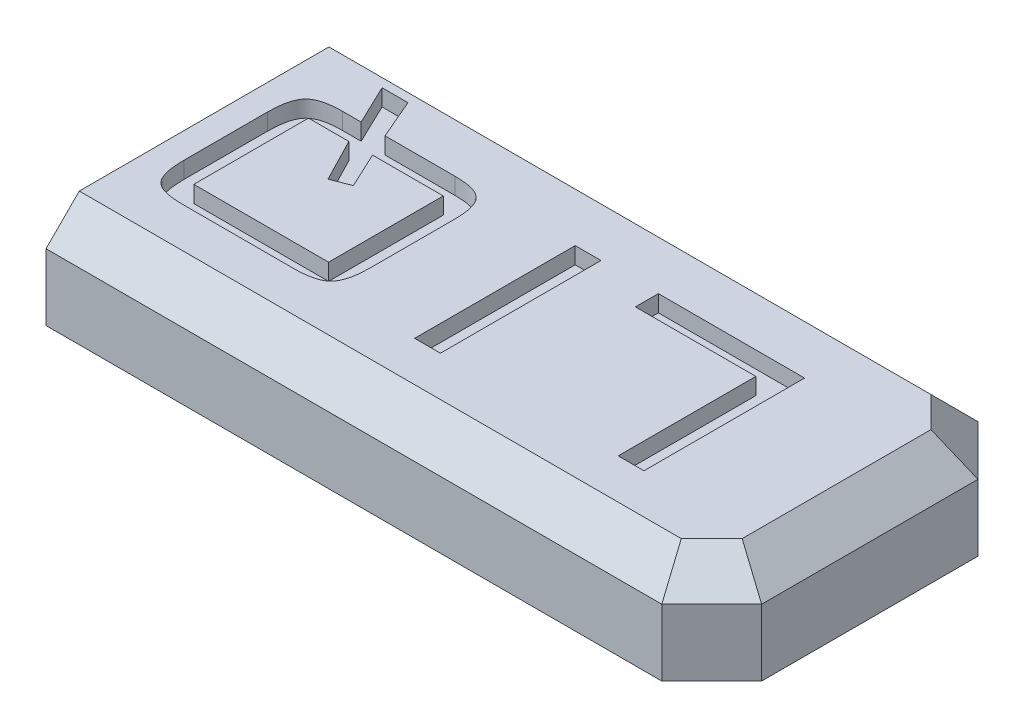
from build123d import *

# Parameters (mm, degrees)
BOSS_EXTRUDE1_DEPTH = 6
SKETCH2_W           = 1.55073591
SKETCH2_H           = 9.649023438
SKETCH2_W_2         = 1.550735909
CUT_EXTRUDE1_DEPTH  = 1
SKETCH4_W           = 43.347942051
SKETCH4_H           = 26.329646459
CUT_EXTRUDE2_DEPTH  = 10
CHAMFER1_SIZE       = 3
CHAMFER2_SIZE       = 2
SKETCH5_W           = 34.860169367
SKETCH5_H           = 17.866082473
CUT_EXTRUDE3_DEPTH  = 0.5
SKETCH6_R           = 4.1
CUT_EXTRUDE4_DEPTH  = 3.4


with BuildPart() as part:
    # Sketch1 → Boss-Extrude1 (new body)
    with BuildSketch(Plane(origin=(0, -196.798939869, 0), x_dir=(1, 0, 0), z_dir=(0, 1, 0))):
        Polygon((-110.695481055, -390.620141885), (-70.695481055, -390.620141885), (-70.695481055, -409.620141885), (-110.695481055, -409.620141885), (-151.695481055, -409.620141885), (-151.695481055, -390.620141885), align=None)
    extrude(amount=BOSS_EXTRUDE1_DEPTH)

    # Sketch2 → Cut-Extrude1 (cut)
    # profile 1 of 6: a face of its own
    with BuildSketch(Plane(origin=(0, -190.798939869, 0), x_dir=(1, 0, 0), z_dir=(0, 1, 0))):
        with BuildLine():
            add(Edge.make_bspline(
                [(-140.767176982, -405.209924667), (-140.982622928, -405.208412821), (-141.394982016, -405.205519181), (-141.98403336, -405.168701103), (-142.517358029, -405.117955452), (-142.996891336, -405.040429638), (-143.431861328, -404.937751856), (-143.828275274, -404.808826708), (-144.192604534, -404.655107583), (-144.412843494, -404.524922655), (-144.520173264, -404.46147921)],
                knots=[0, 0, 0, 0, 1.333778163, 2.552823848, 3.653108193, 4.649746513, 5.558133507, 6.417402386, 7.228747549, 8, 8, 8, 8], degree=3))
            add(Edge.make_bspline(
                [(-144.520173264, -404.46147921), (-144.672688651, -404.354540566), (-144.977706991, -404.140671998), (-145.372980808, -403.740179693), (-145.72204175, -403.288685781), (-146.015251375, -402.783895607), (-146.252341242, -402.23844628), (-146.422101614, -401.66260039), (-146.524137936, -401.061196848), (-146.537803169, -400.652341907), (-146.544745145, -400.444642444)],
                knots=[0, 0, 0, 0, 0.952297785, 1.904517931, 2.867930349, 3.869019748, 4.885904814, 5.906780791, 6.936638737, 8, 8, 8, 8], degree=3))
            add(Edge.make_bspline(
                [(-146.544745145, -400.444642444), (-146.539017026, -400.224388593), (-146.527802756, -399.793184944), (-146.425839385, -399.164163809), (-146.258098069, -398.569953885), (-146.027848138, -398.012133469), (-145.734933397, -397.499500284), (-145.384408604, -397.041985203), (-144.985328734, -396.634035669), (-144.675593052, -396.417833194), (-144.520173264, -396.309346685)],
                knots=[0, 0, 0, 0, 1.100129358, 2.153786604, 3.174592563, 4.179911314, 5.162319574, 6.115853573, 7.05456925, 8, 8, 8, 8], degree=3))
            add(Edge.make_bspline(
                [(-144.520173264, -396.309346685), (-144.415407214, -396.247970567), (-144.198209286, -396.120727383), (-143.840423238, -395.967019912), (-143.444768852, -395.841274433), (-143.011380567, -395.735735637), (-142.529145335, -395.655193263), (-141.993148894, -395.601522013), (-141.399450617, -395.565451573), (-140.984411915, -395.562464625), (-140.767176982, -395.560901229)],
                knots=[0, 0, 0, 0, 0.751413761, 1.557809164, 2.404944974, 3.320203742, 4.317937033, 5.430050062, 6.654865437, 8, 8, 8, 8], degree=3))
            Line((-140.767176982, -395.560901229), (-135.517289788, -395.560901229))
            Line((-135.517289788, -395.560901229), (-135.517289788, -405.209924667))
            Line((-135.517289788, -405.209924667), (-140.767176982, -405.209924667))
        make_face()
        with BuildLine():
            Line((-140.538335746, -403.831492747), (-137.068025698, -403.831492747))
            Line((-137.068025698, -403.831492747), (-137.068025698, -396.939333149))
            Line((-137.068025698, -396.939333149), (-140.538335746, -396.939333149))
            add(Edge.make_bspline(
                [(-140.538335746, -396.939333149), (-140.726862755, -396.941898287), (-141.089956251, -396.946838613), (-141.61301485, -396.984845883), (-142.093527417, -397.044798091), (-142.531495923, -397.132160177), (-142.925368528, -397.248552244), (-143.278930228, -397.383732816), (-143.589154837, -397.547989389), (-143.856977936, -397.741453756), (-144.088661152, -397.964049484), (-144.285418794, -398.219866085), (-144.453911174, -398.507093156), (-144.587443165, -398.829479607), (-144.695661065, -399.182540893), (-144.769772109, -399.569730192), (-144.811875271, -399.989610443), (-144.818346787, -400.28031641), (-144.821705246, -400.431181195)],
                knots=[0, 0, 0, 0, 1.40931624, 2.714271877, 3.918424909, 5.027624621, 6.048757475, 6.985660279, 7.853111911, 8.665027323, 9.447928266, 10.246427284, 11.070312611, 11.930128696, 12.849083366, 13.826707191, 14.872147839, 16, 16, 16, 16], degree=3))
            add(Edge.make_bspline(
                [(-144.821705246, -400.431181195), (-144.818709771, -400.576712398), (-144.812924864, -400.857764438), (-144.765683368, -401.263673078), (-144.694488189, -401.639383199), (-144.580929863, -401.980833169), (-144.445105089, -402.294186016), (-144.27545686, -402.57538752), (-144.073112413, -402.824282209), (-143.83895635, -403.042456395), (-143.566561363, -403.230826533), (-143.2546296, -403.391353977), (-142.901690894, -403.528470783), (-142.507862117, -403.640795062), (-142.072601063, -403.725173206), (-141.597799376, -403.786080538), (-141.081882008, -403.823960231), (-140.724169188, -403.828917449), (-140.538335746, -403.831492747)],
                knots=[0, 0, 0, 0, 1.1029475, 2.130028734, 3.094733, 3.996236287, 4.852145578, 5.679426148, 6.477428238, 7.276560664, 8.097578654, 8.980088779, 9.930191586, 10.963809582, 12.080624623, 13.288249086, 14.591233026, 16, 16, 16, 16], degree=3))
        make_face(mode=Mode.SUBTRACT)
    # profile 2 of 6: a face of its own
    with BuildSketch(Plane(origin=(0, -190.798939869, 0), x_dir=(1, 0, 0), z_dir=(0, 1, 0))):
        with Locations((-129.745106125, -400.385412948)):
            Rectangle(SKETCH2_W, SKETCH2_H)
    # profile 3 of 6: a face of its own
    with BuildSketch(Plane(origin=(0, -190.798939869, 0), x_dir=(1, 0, 0), z_dir=(0, 1, 0))):
        with BuildLine():
            Line((-115.357722964, -405.209924667), (-115.357722964, -396.939333149))
            Line((-115.357722964, -396.939333149), (-122.422186552, -396.939333149))
            Line((-122.422186552, -396.939333149), (-122.422186552, -405.209924667))
            Line((-122.422186552, -405.209924667), (-123.972922461, -405.209924667))
            Line((-123.972922461, -405.209924667), (-123.972922461, -397.876236094))
            add(Edge.make_bspline(
                [(-123.972922461, -397.876236094), (-123.97130062, -397.768503726), (-123.968175155, -397.560891645), (-123.946562754, -397.263453332), (-123.913361153, -396.992319774), (-123.861781613, -396.749497692), (-123.798905063, -396.532206755), (-123.717930323, -396.342601202), (-123.623893906, -396.179127334), (-123.51405496, -396.039134081), (-123.380645379, -395.924069451), (-123.223997755, -395.826555258), (-123.043098505, -395.743432714), (-122.835801675, -395.677092248), (-122.603622791, -395.623157153), (-122.345091238, -395.586720416), (-122.061773796, -395.565800066), (-121.864927889, -395.56257696), (-121.76258534, -395.560901229)],
                knots=[0, 0, 0, 0, 1.365025829, 2.630554399, 3.777289411, 4.823296905, 5.773086012, 6.639126, 7.429026898, 8.157168554, 8.882463115, 9.649102086, 10.488604984, 11.398409027, 12.402469484, 13.50569655, 14.703181711, 16, 16, 16, 16], degree=3))
            Line((-121.76258534, -395.560901229), (-116.009247426, -395.560901229))
            add(Edge.make_bspline(
                [(-116.009247426, -395.560901229), (-115.906920359, -395.562687865), (-115.710104231, -395.566124284), (-115.427333413, -395.58552546), (-115.171085642, -395.626525893), (-114.940696482, -395.680226348), (-114.733396449, -395.745508539), (-114.553275043, -395.832261863), (-114.396325587, -395.931154528), (-114.266726678, -396.050908492), (-114.154943277, -396.190042043), (-114.062808079, -396.355700348), (-113.981390872, -396.544829811), (-113.917656822, -396.761041229), (-113.866888225, -397.002247145), (-113.833414163, -397.270620412), (-113.811650677, -397.564474201), (-113.808585204, -397.769400211), (-113.806987054, -397.876236094)],
                knots=[0, 0, 0, 0, 1.301446602, 2.503205558, 3.60080036, 4.597332017, 5.510383128, 6.357737689, 7.133266863, 7.860254787, 8.590995162, 9.393593455, 10.262724318, 11.204977956, 12.254718625, 13.394230236, 14.64151108, 16, 16, 16, 16], degree=3))
            Line((-113.806987054, -397.876236094), (-113.806987054, -405.209924667))
            Line((-113.806987054, -405.209924667), (-115.357722964, -405.209924667))
        make_face()
    # profile 4 of 6: a face of its own
    with BuildSketch(Plane(origin=(0, -190.798939869, 0), x_dir=(1, 0, 0), z_dir=(0, 1, 0))):
        with BuildLine():
            add(Edge.make_bspline(
                [(-97.955019978, -402.870359553), (-97.956652565, -402.978088999), (-97.959798739, -403.185695451), (-97.981268964, -403.483172415), (-98.015048775, -403.755050365), (-98.065378023, -403.999133459), (-98.1304323, -404.217037438), (-98.206687836, -404.40992551), (-98.301548404, -404.575336569), (-98.411034046, -404.718120224), (-98.544442988, -404.835934988), (-98.701069946, -404.936199437), (-98.882708774, -405.022503111), (-99.090920415, -405.091152386), (-99.324340246, -405.145039922), (-99.583864206, -405.180769412), (-99.869613361, -405.206059906), (-100.069270672, -405.208599655), (-100.173433849, -405.209924667)],
                knots=[0, 0, 0, 0, 1.356221993, 2.613588442, 3.7529275, 4.803245948, 5.746909319, 6.613424892, 7.408010909, 8.14031288, 8.868419245, 9.636206373, 10.47510186, 11.393329314, 12.390914008, 13.487025728, 14.688956683, 16, 16, 16, 16], degree=3))
            Line((-100.173433849, -405.209924667), (-106.936365454, -405.209924667))
            add(Edge.make_bspline(
                [(-106.936365454, -405.209924667), (-107.03959143, -405.208168009), (-107.237308227, -405.204803345), (-107.521846366, -405.185117085), (-107.779867844, -405.144247356), (-108.01302586, -405.090709797), (-108.221545349, -405.025218465), (-108.404305019, -404.941105061), (-108.562292124, -404.842079279), (-108.695959314, -404.723411798), (-108.805834581, -404.580848257), (-108.899064948, -404.415265905), (-108.981397593, -404.224482592), (-109.043478168, -404.005085856), (-109.09525377, -403.759657576), (-109.128239011, -403.486707323), (-109.150133277, -403.187505345), (-109.153187914, -402.978991502), (-109.154779325, -402.870359553)],
                knots=[0, 0, 0, 0, 1.299210286, 2.488479226, 3.585823455, 4.582994824, 5.497291421, 6.331034297, 7.108000517, 7.835805208, 8.567803767, 9.362060566, 10.222158455, 11.176253704, 12.226136976, 13.376204297, 14.633049786, 16, 16, 16, 16], degree=3))
            Line((-109.154779325, -402.870359553), (-109.154779325, -397.854698095))
            add(Edge.make_bspline(
                [(-109.154779325, -397.854698095), (-109.153151378, -397.747864039), (-109.150015111, -397.542046438), (-109.128503265, -397.247278496), (-109.094894709, -396.978008156), (-109.044020497, -396.736842057), (-108.980901322, -396.521291491), (-108.899001076, -396.334013033), (-108.80658263, -396.171325929), (-108.69573208, -396.033634198), (-108.561285836, -395.920666277), (-108.403637682, -395.824563938), (-108.221581059, -395.740232658), (-108.01335545, -395.674186162), (-107.77970286, -395.624053469), (-107.52162289, -395.586441232), (-107.237333904, -395.5658101), (-107.039600238, -395.562585014), (-106.936365454, -395.560901229)],
                knots=[0, 0, 0, 0, 1.357245466, 2.61475614, 3.753224731, 4.80200455, 5.743395722, 6.6012629, 7.393257341, 8.114460715, 8.834220599, 9.61255537, 10.454283276, 11.377336392, 12.381536746, 13.487687791, 14.68834675, 16, 16, 16, 16], degree=3))
            Line((-106.936365454, -395.560901229), (-105.81908177, -395.560901229))
            Line((-105.81908177, -395.560901229), (-106.974056952, -393.14864537))
            Line((-106.974056952, -393.14864537), (-105.420628793, -393.14864537))
            Line((-105.420628793, -393.14864537), (-104.384112603, -395.560901229))
            Line((-104.384112603, -395.560901229), (-100.173433849, -395.560901229))
            add(Edge.make_bspline(
                [(-100.173433849, -395.560901229), (-100.069299861, -395.562576695), (-99.869770228, -395.565787032), (-99.583710784, -395.586483719), (-99.324398952, -395.623381546), (-99.090777766, -395.67665049), (-98.883528866, -395.746452514), (-98.700271675, -395.828557698), (-98.545451596, -395.929855275), (-98.410938513, -396.044261005), (-98.302420462, -396.184244467), (-98.205884472, -396.345061043), (-98.130494516, -396.534972277), (-98.066128283, -396.748472614), (-98.014313393, -396.98778752), (-97.981722229, -397.253596433), (-97.959616393, -397.545617805), (-97.95659546, -397.74875672), (-97.955019978, -397.854698095)],
                knots=[0, 0, 0, 0, 1.324586597, 2.538021266, 3.64545599, 4.653345889, 5.581058773, 6.423763498, 7.199481985, 7.927542786, 8.658461541, 9.441536144, 10.306446208, 11.248929857, 12.276599877, 13.416389652, 14.652590838, 16, 16, 16, 16], degree=3))
            Line((-97.955019978, -397.854698095), (-97.955019978, -402.870359553))
        make_face()
        Polygon((-105.178326307, -396.939333149), (-107.604043416, -396.939333149), (-107.604043416, -403.831492747), (-99.505755888, -403.831492747), (-99.505755888, -396.939333149), (-103.75412614, -396.939333149), (-102.744532449, -399.106594272), (-103.845662635, -399.523892998), align=None, mode=Mode.SUBTRACT)
    # profile 5 of 6: a face of its own
    with BuildSketch(Plane(origin=(0, -190.798939869, 0), x_dir=(1, 0, 0), z_dir=(0, 1, 0))):
        with Locations((-92.182836315, -400.385412948)):
            Rectangle(SKETCH2_W_2, SKETCH2_H)
    # profile 6 of 6: a face of its own
    with BuildSketch(Plane(origin=(0, -190.798939869, 0), x_dir=(1, 0, 0), z_dir=(0, 1, 0))):
        Polygon((-79.173885073, -395.560901229), (-79.173885073, -405.209924667), (-80.724620983, -405.209924667), (-80.724620983, -396.939333149), (-87.961388561, -396.939333149), (-87.961388561, -395.560901229), align=None)
    extrude(amount=-CUT_EXTRUDE1_DEPTH, mode=Mode.SUBTRACT)

    # Sketch4 → Cut-Extrude2 (cut)
    with BuildSketch(Plane(origin=(0, -190.798939869, 0), x_dir=(1, 0, 0), z_dir=(0, 1, 0))):
        with Locations((-132.86945208, -396.455318656)):
            Rectangle(SKETCH4_W, SKETCH4_H)
    extrude(amount=-CUT_EXTRUDE2_DEPTH, mode=Mode.SUBTRACT)

    # Chamfer1
    chamfer1_edges = [part.edges().sort_by_distance(p)[0] for p in [
        (-70.695481055, -193.798939869, 390.620141885),
        (-70.695481055, -193.798939869, 409.620141885),
    ]]
    chamfer(chamfer1_edges, length=CHAMFER1_SIZE)

    # Chamfer2
    chamfer2_edges = [part.edges().sort_by_distance(p)[0] for p in [
        (-92.445481055, -190.798939869, 409.620141885),
        (-92.445481055, -190.798939869, 390.620141885),
        (-70.695481055, -190.798939869, 400.120141885),
        (-72.195481055, -190.798939869, 408.120141885),
        (-72.195481055, -190.798939869, 392.120141885),
    ]]
    chamfer(chamfer2_edges, length=CHAMFER2_SIZE)

    # Sketch5 → Cut-Extrude3 (cut)
    with BuildSketch(Plane.ZY.offset(111.195481055)):
        with Locations((401.477645416, -193.610788767)):
            Rectangle(SKETCH5_W, SKETCH5_H)
    extrude(amount=-CUT_EXTRUDE3_DEPTH, mode=Mode.SUBTRACT)

    # Sketch6 → Cut-Extrude4 (cut)
    with BuildSketch(Plane.XZ.offset(196.798939869)):
        with Locations(Location((-91.195481055, 400.120141885, 0), (0, 0, 270))):
            Circle(SKETCH6_R)
    extrude(amount=-CUT_EXTRUDE4_DEPTH, mode=Mode.SUBTRACT)


solid = part.part
